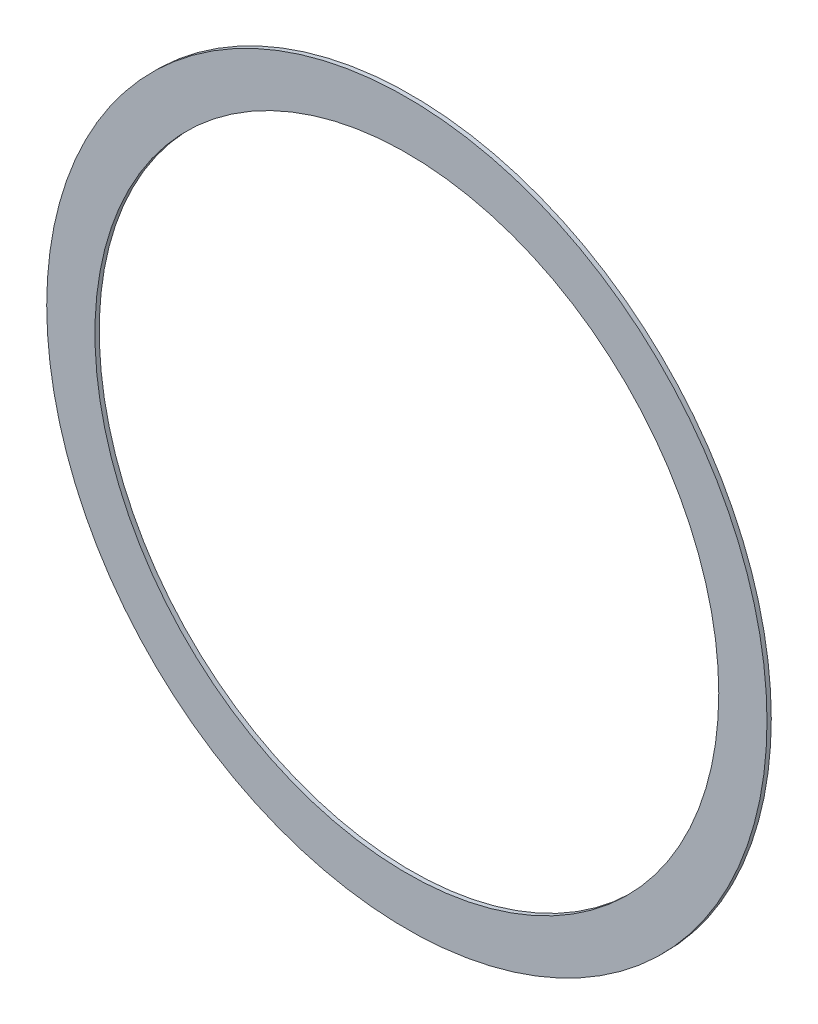
from build123d import *

# Parameters (mm, degrees)
SKETCH1_R           = 266.7
SKETCH1_R_2         = 230.98125
BOSS_EXTRUDE1_DEPTH = 3.175


with BuildPart() as part:
    # Sketch1 → Boss-Extrude1 (new body)
    with BuildSketch(Plane.XY):
        Circle(SKETCH1_R)
        Circle(SKETCH1_R_2, mode=Mode.SUBTRACT)
    extrude(amount=BOSS_EXTRUDE1_DEPTH)


solid = part.part
